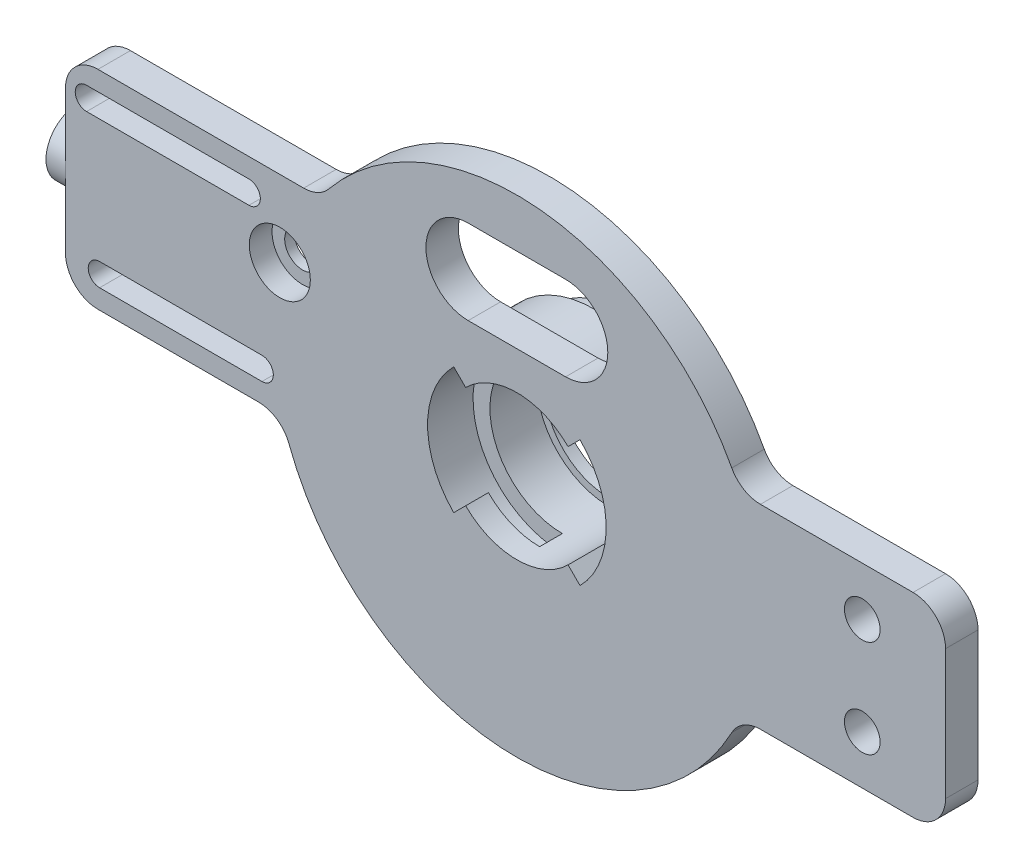
from build123d import *

# Parameters (mm, degrees)
SKETCH2_R                = 37.5
SKETCH2_R_2              = 4.2
BOSS_EXTRUDE1_DEPTH      = 5
SKETCH3_R                = 11.15
CUT_EXTRUDE1_DEPTH       = 76.967098141
SKETCH5_R                = 14.15
SKETCH5_R_2              = 11.15
BOSS_EXTRUDE2_DEPTH      = 10
BOSS_EXTRUDE3_START      = -2
SKETCH6_R                = 14.15
SKETCH6_R_2              = 9
BOSS_EXTRUDE3_DEPTH      = 2
SKETCH7_R                = 11.15
CUT_EXTRUDE2_DEPTH       = 10
SKETCH8_R                = 14.15
SKETCH8_R_2              = 10
BOSS_EXTRUDE4_DEPTH      = 2
BOSS_EXTRUDE5_DEPTH      = 5
BOSS_EXTRUDE5_DEPTH_BACK = 5
SKETCH10_W               = 10
SKETCH10_H               = 30
BOSS_EXTRUDE6_DEPTH      = 10
CUT_EXTRUDE3_START       = -5
CUT_EXTRUDE3_DEPTH       = 5
SKETCH12_R               = 2.75
CUT_EXTRUDE4_DEPTH       = 78.472575793
BOSS_EXTRUDE7_DEPTH      = 5
SKETCH15_R               = 13.75
CUT_EXTRUDE5_DEPTH       = 7
SKETCH17_R               = 16.25
SKETCH17_R_2             = 14.15
BOSS_EXTRUDE8_DEPTH      = 7
BOSS_EXTRUDE9_START      = 7
BOSS_EXTRUDE9_DEPTH      = 7
CUT_EXTRUDE7_START       = 3.5
CUT_EXTRUDE7_DEPTH       = 3.5
SKETCH20_R               = 11.15
CUT_EXTRUDE8_DEPTH       = 0.2
BOSS_EXTRUDE10_DEPTH     = 5
SKETCH22_W               = 5
SKETCH22_H               = 20
BOSS_EXTRUDE11_DEPTH     = 7
SKETCH23_W               = 23.357919263
SKETCH23_H               = 5
BOSS_EXTRUDE12_DEPTH     = 12
SKETCH24_W               = 5
SKETCH24_H               = 12
BOSS_EXTRUDE13_DEPTH     = 12
SKETCH25_W               = 5
SKETCH25_H               = 32
BOSS_EXTRUDE14_DEPTH     = 10
CUT_EXTRUDE9_DEPTH       = 105.546640309
FILLET2_R                = 5
SKETCH27_W               = 14.087346568
SKETCH27_H               = 5
CUT_EXTRUDE10_DEPTH      = 110.569612576
SKETCH28_R               = 2.75
BOSS_EXTRUDE15_DEPTH     = 5
SKETCH29_W               = 5
SKETCH29_H               = 30
BOSS_EXTRUDE16_DEPTH     = 15
SKETCH30_R               = 2.75
CUT_EXTRUDE12_DEPTH      = 15
FILLET3_R                = 5
BOSS_EXTRUDE18_DEPTH     = 3
SKETCH34_R               = 2.75
CUT_EXTRUDE13_DEPTH      = 108.224064463
SKETCH35_R               = 4.7
CUT_EXTRUDE14_DEPTH      = 3.5


with BuildPart() as part:
    # Sketch2 → Boss-Extrude1 (new body)
    with BuildSketch(Plane(origin=(0, 0, -8.5), x_dir=(-1, 0, 0), z_dir=(0, 0, -1))):
        with Locations((23.5, 7.5)):
            Circle(SKETCH2_R)
        with Locations((23.5, 7.5)):
            Circle(SKETCH2_R_2, mode=Mode.SUBTRACT)
        with BuildLine():
            ThreePointArc((31, 24.5), (37.5, 31), (31, 37.5))
            Line((31, 37.5), (16, 37.5))
            ThreePointArc((16, 37.5), (9.5, 31), (16, 24.5))
            Line((16, 24.5), (31, 24.5))
        make_face(mode=Mode.SUBTRACT)
    extrude(amount=BOSS_EXTRUDE1_DEPTH)

    # Sketch3 → Cut-Extrude1 (cut, through all)
    with BuildSketch(Plane.XY.offset(-8.5)):
        with Locations((-23.5, 7.5)):
            Circle(SKETCH3_R)
    extrude(amount=-CUT_EXTRUDE1_DEPTH, mode=Mode.SUBTRACT)

    # Sketch5 → Boss-Extrude2 (add)
    with BuildSketch(Plane(origin=(0, 0, -13.5), x_dir=(-1, 0, 0), z_dir=(0, 0, -1))):
        with Locations((23.5, 7.5)):
            Circle(SKETCH5_R)
        with Locations(Location((23.5, 7.5, 0), (0, 0, 180))):
            Circle(SKETCH5_R_2, mode=Mode.SUBTRACT)
    extrude(amount=BOSS_EXTRUDE2_DEPTH)

    # Sketch6 → Boss-Extrude3 (add)
    with BuildSketch(Plane(origin=(0, 0, -23.5), x_dir=(-1, 0, 0), z_dir=(0, 0, -1)).offset(BOSS_EXTRUDE3_START)):
        with Locations((23.5, 7.5)):
            Circle(SKETCH6_R)
        with Locations((23.5, 7.5)):
            Circle(SKETCH6_R_2, mode=Mode.SUBTRACT)
    extrude(amount=BOSS_EXTRUDE3_DEPTH)

    # Sketch7 → Cut-Extrude2 (cut)
    with BuildSketch(Plane.XY.offset(-21.5)):
        with Locations((-23.5, 7.5)):
            Circle(SKETCH7_R)
    extrude(amount=-CUT_EXTRUDE2_DEPTH, mode=Mode.SUBTRACT)

    # Sketch8 → Boss-Extrude4 (add)
    with BuildSketch(Plane(origin=(0, 0, -22.5), x_dir=(-1, 0, 0), z_dir=(0, 0, -1))):
        with Locations((23.5, 7.5)):
            Circle(SKETCH8_R)
        with Locations((23.5, 7.5)):
            Circle(SKETCH8_R_2, mode=Mode.SUBTRACT)
    extrude(amount=BOSS_EXTRUDE4_DEPTH)

    # Sketch9 → Boss-Extrude5 (add, two sides: drawn at the far end of the back side and taken through both)
    with BuildSketch(Plane.XY.offset(-8.5).offset(-BOSS_EXTRUDE5_DEPTH_BACK)):
        with BuildLine():
            Line((17.5, 22.5), (10.869317712, 22.5))
            ThreePointArc((10.869317712, 22.5), (13.208986735, 15.161611638), (14, 7.5))
            ThreePointArc((14, 7.5), (13.208986735, -0.161611638), (10.869317712, -7.5))
            Line((10.869317712, -7.5), (17.5, -7.5))
            Line((17.5, -7.5), (17.5, 22.5))
        make_face()
        with BuildLine():
            Line((10.869317712, 22.5), (8.122776602, 22.5))
            ThreePointArc((8.122776602, 22.5), (10.645257219, 15.187744108), (11.5, 7.5))
            ThreePointArc((11.5, 7.5), (10.645257219, -0.187744108), (8.122776602, -7.5))
            Line((8.122776602, -7.5), (10.869317712, -7.5))
            ThreePointArc((10.869317712, -7.5), (13.208986735, -0.161611638), (14, 7.5))
            ThreePointArc((14, 7.5), (13.208986735, 15.161611638), (10.869317712, 22.5))
        make_face()
    extrude(amount=BOSS_EXTRUDE5_DEPTH + BOSS_EXTRUDE5_DEPTH_BACK)

    # Sketch10 → Boss-Extrude6 (add)
    with BuildSketch(Plane(origin=(17.5, 0, 0), x_dir=(0, 0, -1), z_dir=(1, 0, 0))):
        with Locations((8.5, 7.5)):
            Rectangle(SKETCH10_W, SKETCH10_H)
    extrude(amount=BOSS_EXTRUDE6_DEPTH)

    # Sketch11 → Cut-Extrude3 (cut)
    with BuildSketch(Plane.XY.offset(-3.5).offset(CUT_EXTRUDE3_START)):
        with BuildLine():
            Line((27.5, 22.5), (8.122776602, 22.5))
            ThreePointArc((8.122776602, 22.5), (11.5, 7.5), (8.122776602, -7.5))
            Line((8.122776602, -7.5), (27.5, -7.5))
            Line((27.5, -7.5), (27.5, 22.5))
        make_face()
    extrude(amount=CUT_EXTRUDE3_DEPTH, mode=Mode.SUBTRACT)

    # Sketch12 → Cut-Extrude4 (cut, through all)
    with BuildSketch(Plane.XY.offset(-8.5)):
        with Locations((17.5, 15)):
            Circle(SKETCH12_R)
        with Locations((17.5, 0)):
            Circle(SKETCH12_R)
    extrude(amount=-CUT_EXTRUDE4_DEPTH, mode=Mode.SUBTRACT)

    # Sketch13 → Boss-Extrude7 (add)
    # profile 1 of 2: a face of its own
    with BuildSketch(Plane(origin=(0, 0, -13.5), x_dir=(-1, 0, 0), z_dir=(0, 0, -1))):
        Polygon((-21.021836642, -6.1), (-13.978163358, -6.1), (-10.456326716, 0), (-13.978163358, 6.1), (-21.021836642, 6.1), (-24.543673284, 0), align=None)
        Polygon((-22.234272207, 0), (-19.867136104, -4.1), (-15.132863896, -4.1), (-12.765727793, 0), (-15.132863896, 4.1), (-19.867136104, 4.1), align=None, mode=Mode.SUBTRACT)
    # profile 2 of 2: a face of its own
    with BuildSketch(Plane(origin=(0, 0, -13.5), x_dir=(-1, 0, 0), z_dir=(0, 0, -1))):
        Polygon((-21.021836642, 8.9), (-13.978163358, 8.9), (-10.456326716, 15), (-13.978163358, 21.1), (-21.021836642, 21.1), (-24.543673284, 15), align=None)
        Polygon((-22.234272207, 15), (-19.867136104, 10.9), (-15.132863896, 10.9), (-12.765727793, 15), (-15.132863896, 19.1), (-19.867136104, 19.1), align=None, mode=Mode.SUBTRACT)
    extrude(amount=BOSS_EXTRUDE7_DEPTH)

    # Sketch15 → Cut-Extrude5 (cut)
    with BuildSketch(Plane.XY.offset(-8.5)):
        with Locations((-23.5, 7.5)):
            Circle(SKETCH15_R)
    extrude(amount=-CUT_EXTRUDE5_DEPTH, mode=Mode.SUBTRACT)

    # Sketch17 → Boss-Extrude8 (add)
    with BuildSketch(Plane(origin=(0, 0, -13.5), x_dir=(-1, 0, 0), z_dir=(0, 0, -1))):
        with Locations((23.5, 7.5)):
            Circle(SKETCH17_R)
        with Locations((23.5, 7.5)):
            Circle(SKETCH17_R_2, mode=Mode.SUBTRACT)
    extrude(amount=BOSS_EXTRUDE8_DEPTH)

    # Sketch18 → Boss-Extrude9 (add)
    with BuildSketch(Plane.XY.offset(-15.5).offset(BOSS_EXTRUDE9_START)):
        with BuildLine():
            ThreePointArc((-31.38424061, 15.38424061), (-27.766920271, 17.801256788), (-23.5, 18.65))
            Line((-23.5, 18.65), (-23.5, 21.25))
            ThreePointArc((-23.5, 21.25), (-28.761897195, 20.203343572), (-33.222718241, 17.222718241))
            Line((-33.222718241, 17.222718241), (-31.38424061, 15.38424061))
        make_face()
        with BuildLine():
            Line((-23.5, 21.25), (-23.5, 18.65))
            ThreePointArc((-23.5, 18.65), (-19.233079729, 17.801256788), (-15.61575939, 15.38424061))
            Line((-15.61575939, 15.38424061), (-13.777281759, 17.222718241))
            ThreePointArc((-13.777281759, 17.222718241), (-18.238102805, 20.203343572), (-23.5, 21.25))
        make_face()
        with BuildLine():
            ThreePointArc((-15.61575939, -0.38424061), (-23.5, -3.65), (-31.38424061, -0.38424061))
            Line((-31.38424061, -0.38424061), (-33.222718241, -2.222718241))
            ThreePointArc((-33.222718241, -2.222718241), (-23.5, -6.25), (-13.777281759, -2.222718241))
            Line((-13.777281759, -2.222718241), (-15.61575939, -0.38424061))
        make_face()
    extrude(amount=-BOSS_EXTRUDE9_DEPTH)

    # Sketch19 → Cut-Extrude7 (cut)
    with BuildSketch(Plane.XY.offset(-15.5).offset(CUT_EXTRUDE7_START)):
        with BuildLine():
            Line((-23.5, 21.25), (-23.5, 18.65))
            ThreePointArc((-23.5, 18.65), (-19.233079729, 17.801256788), (-15.61575939, 15.38424061))
            Line((-15.61575939, 15.38424061), (-13.777281759, 17.222718241))
            ThreePointArc((-13.777281759, 17.222718241), (-18.238102805, 20.203343572), (-23.5, 21.25))
        make_face()
        with BuildLine():
            Line((-23.5, -6.25), (-23.5, -3.65))
            ThreePointArc((-23.5, -3.65), (-27.766920271, -2.801256788), (-31.38424061, -0.38424061))
            Line((-31.38424061, -0.38424061), (-33.222718241, -2.222718241))
            ThreePointArc((-33.222718241, -2.222718241), (-28.761897195, -5.203343572), (-23.5, -6.25))
        make_face()
    extrude(amount=-CUT_EXTRUDE7_DEPTH, mode=Mode.SUBTRACT)

    # Sketch20 → Cut-Extrude8 (cut)
    with BuildSketch(Plane.XY.offset(-22.5)):
        with Locations((-23.5, 7.5)):
            Circle(SKETCH20_R)
    extrude(amount=-CUT_EXTRUDE8_DEPTH, mode=Mode.SUBTRACT)

    # Sketch21 → Boss-Extrude10 (add)
    with BuildSketch(Plane.XY.offset(-8.5)):
        with BuildLine():
            Line((-76, 7.5), (-61, 7.5))
            ThreePointArc((-61, 7.5), (-60.658969493, 12.545888047), (-59.642080737, 17.5))
            Line((-59.642080737, 17.5), (-61, 17.5))
            Line((-61, 17.5), (-76, 17.5))
            Line((-76, 17.5), (-76, 7.5))
        make_face()
        with BuildLine():
            ThreePointArc((-59.642080737, -2.5), (-60.658969493, 2.454111953), (-61, 7.5))
            Line((-61, 7.5), (-76, 7.5))
            Line((-76, 7.5), (-76, -2.5))
            Line((-76, -2.5), (-61, -2.5))
            Line((-61, -2.5), (-59.642080737, -2.5))
        make_face()
    extrude(amount=-BOSS_EXTRUDE10_DEPTH)

    # Sketch22 → Boss-Extrude11 (add)
    with BuildSketch(Plane.ZY.offset(76)):
        with Locations((-11, 7.5)):
            Rectangle(SKETCH22_W, SKETCH22_H)
    extrude(amount=BOSS_EXTRUDE11_DEPTH)

    # Sketch23 → Boss-Extrude12 (add)
    with BuildSketch(Plane(origin=(0, 17.5, 0), x_dir=(1, 0, 0), z_dir=(0, 1, 0))):
        with Locations((-71.321040369, 11)):
            Rectangle(SKETCH23_W, SKETCH23_H)
    extrude(amount=BOSS_EXTRUDE12_DEPTH)

    # Sketch24 → Boss-Extrude13 (add)
    with BuildSketch(Plane(origin=(-59.642080737, 0, 0), x_dir=(0, 0, -1), z_dir=(1, 0, 0))):
        with Locations((11, 23.5)):
            Rectangle(SKETCH24_W, SKETCH24_H)
    extrude(amount=BOSS_EXTRUDE13_DEPTH)

    # Sketch25 → Boss-Extrude14 (add)
    with BuildSketch(Plane.ZY.offset(83)):
        with Locations((-11, 13.5)):
            Rectangle(SKETCH25_W, SKETCH25_H)
    extrude(amount=BOSS_EXTRUDE14_DEPTH)

    # Sketch26 → Cut-Extrude9 (cut, through all)
    with BuildSketch(Plane.XY.offset(-8.5)):
        with BuildLine():
            Line((-64.75, 23), (-89.75, 23))
            ThreePointArc((-89.75, 23), (-91.5, 24.75), (-89.75, 26.5))
            Line((-89.75, 26.5), (-64.75, 26.5))
            ThreePointArc((-64.75, 26.5), (-63, 24.75), (-64.75, 23))
        make_face()
        with BuildLine():
            Line((-87.75, 4), (-62.75, 4))
            ThreePointArc((-62.75, 4), (-61, 2.25), (-62.75, 0.5))
            Line((-62.75, 0.5), (-87.75, 0.5))
            ThreePointArc((-87.75, 0.5), (-89.5, 2.25), (-87.75, 4))
        make_face()
    extrude(amount=-CUT_EXTRUDE9_DEPTH, mode=Mode.SUBTRACT)

    # Fillet2
    fillet2_edges = [part.edges().sort_by_distance(p)[0] for p in [
        (-59.642080737, -2.5, -11),
        (-53.868569278, 29.5, -11),
        (-93, -2.5, -11),
        (-93, 29.5, -11),
    ]]
    fillet(fillet2_edges, radius=FILLET2_R)

    # Sketch27 → Cut-Extrude10 (cut, through all)
    with BuildSketch(Plane(origin=(0, 22.5, 0), x_dir=(1, 0, 0), z_dir=(0, 1, 0))):
        with Locations((17.5, 16)):
            Rectangle(SKETCH27_W, SKETCH27_H)
    extrude(amount=-CUT_EXTRUDE10_DEPTH, mode=Mode.SUBTRACT)

    # Sketch28 → Boss-Extrude15 (add)
    with BuildSketch(Plane.XY.offset(-8.5)):
        with Locations((17.5, 0)):
            Circle(SKETCH28_R)
        with Locations((17.5, 15)):
            Circle(SKETCH28_R)
    extrude(amount=-BOSS_EXTRUDE15_DEPTH)

    # Sketch29 → Boss-Extrude16 (add)
    with BuildSketch(Plane(origin=(27.5, 0, 0), x_dir=(0, 0, -1), z_dir=(1, 0, 0))):
        with Locations((11, 7.5)):
            Rectangle(SKETCH29_W, SKETCH29_H)
    extrude(amount=BOSS_EXTRUDE16_DEPTH)

    # Sketch30 → Cut-Extrude12 (cut)
    with BuildSketch(Plane.XY.offset(-8.5)):
        with Locations((29.682858342, 15)):
            Circle(SKETCH30_R)
        with Locations((29.682858342, 0)):
            Circle(SKETCH30_R)
    extrude(amount=-CUT_EXTRUDE12_DEPTH, mode=Mode.SUBTRACT)

    # Fillet3
    fillet3_edges = [part.edges().sort_by_distance(p)[0] for p in [
        (42.5, 22.5, -11),
        (42.5, -7.5, -11),
        (10.869317712, 22.5, -11),
        (10.869317712, -7.5, -11),
    ]]
    fillet(fillet3_edges, radius=FILLET3_R)

    # Sketch33 → Boss-Extrude18 (add)
    with BuildSketch(Plane.ZY.offset(93)):
        with BuildLine():
            ThreePointArc((-13.5, 8.5), (-9.964466094, 9.964466094), (-8.5, 13.5))
            Line((-8.5, 13.5), (-13.5, 13.5))
            Line((-13.5, 13.5), (-13.5, 8.5))
        make_face()
        with BuildLine():
            Line((-13.5, 13.5), (-8.5, 13.5))
            ThreePointArc((-8.5, 13.5), (-9.964466094, 17.035533906), (-13.5, 18.5))
            Line((-13.5, 18.5), (-13.5, 13.5))
        make_face()
        with BuildLine():
            Line((-13.5, 8.5), (-13.5, 13.5))
            Line((-13.5, 13.5), (-18.5, 13.5))
            ThreePointArc((-18.5, 13.5), (-17.035533906, 9.964466094), (-13.5, 8.5))
        make_face()
        with BuildLine():
            Line((-18.5, 13.5), (-13.5, 13.5))
            Line((-13.5, 13.5), (-13.5, 18.5))
            ThreePointArc((-13.5, 18.5), (-17.035533906, 17.035533906), (-18.5, 13.5))
        make_face()
    extrude(amount=BOSS_EXTRUDE18_DEPTH)

    # Sketch34 → Cut-Extrude13 (cut, through all)
    with BuildSketch(Plane.XY.offset(-8.5)):
        with Locations((-60, 17.75)):
            Circle(SKETCH34_R)
    extrude(amount=-CUT_EXTRUDE13_DEPTH, mode=Mode.SUBTRACT)

    # Sketch35 → Cut-Extrude14 (cut)
    with BuildSketch(Plane.XY.offset(-8.5)):
        with Locations((-60, 17.75)):
            Circle(SKETCH35_R)
    extrude(amount=-CUT_EXTRUDE14_DEPTH, mode=Mode.SUBTRACT)


solid = part.part
